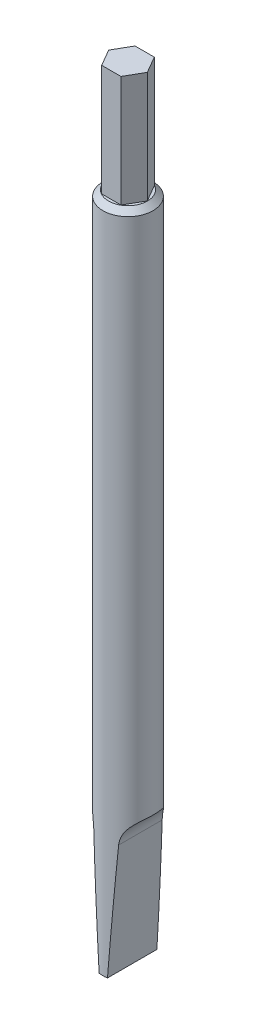
from build123d import *

# Parameters (mm, degrees)
BOSS_EXTRUDE1_DEPTH = 20
SKETCH2_R           = 4.5
BOSS_EXTRUDE2_DEPTH = 120
CHAMFER1_SIZE       = 1
CUT_EXTRUDE1_DEPTH  = 10


with BuildPart() as part:
    # Sketch1 → Boss-Extrude1 (new body)
    with BuildSketch(Plane(origin=(0, 0, 0), x_dir=(1, 0, 0), z_dir=(0, 1, 0))):
        Polygon((3.464101615, 0), (1.732050808, 3), (-1.732050808, 3), (-3.464101615, 0), (-1.732050808, -3), (1.732050808, -3), align=None)
    extrude(amount=BOSS_EXTRUDE1_DEPTH)

    # Sketch2 → Boss-Extrude2 (add)
    with BuildSketch(Plane(origin=(0, 0, 0), x_dir=(1, 0, 0), z_dir=(0, 1, 0))):
        with Locations(Location((0, 0, 0), (0, 0, 270))):
            Circle(SKETCH2_R)
    extrude(amount=-BOSS_EXTRUDE2_DEPTH)

    # Chamfer1
    chamfer1_edges = [part.edges().sort_by_distance(p)[0] for p in [
        (0, 0, -4.5),
    ]]
    chamfer(chamfer1_edges, length=CHAMFER1_SIZE)

    # Sketch4 → Cut-Extrude1 (cut, symmetric)
    with BuildSketch(Plane.XY.offset(3)):
        with BuildLine():
            Line((2.229044758, -98.848674543), (0.75, -120))
            Line((0.75, -120), (4.5, -120))
            Line((4.5, -120), (4.5, -95))
            ThreePointArc((4.5, -95), (2.910634909, -96.656515683), (2.229044758, -98.848674543))
        make_face()
    cut_extrude1 = extrude(amount=CUT_EXTRUDE1_DEPTH, both=True, mode=Mode.SUBTRACT)

    # Mirror1: Cut-Extrude1 across plane
    add(cut_extrude1.mirror(Plane(origin=(0, 0, 0), x_dir=(0, 0, 1), z_dir=(1, 0, 0))), mode=Mode.SUBTRACT)


solid = part.part
